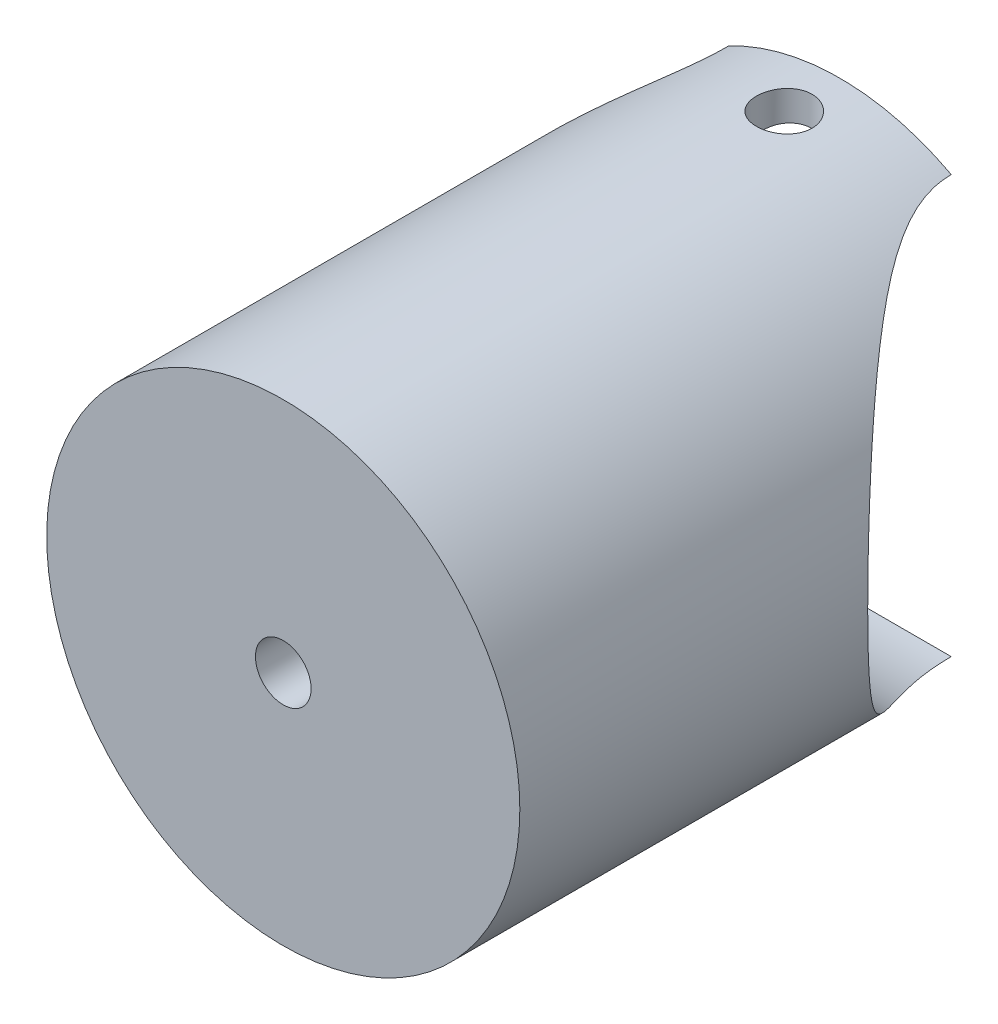
from build123d import *

# Parameters (mm, degrees)
SKETCH1_R               = 85
BOSS_EXTRUDE1_DEPTH     = 200
CUT_EXTRUDE1_DEPTH      = 234.345237792
CUT_EXTRUDE1_DEPTH_BACK = 234.345237792
SKETCH2_R               = 75
CUT_EXTRUDE3_DEPTH      = 234.34523795
CUT_EXTRUDE3_DEPTH_BACK = 234.34523795
SKETCH3_R               = 10
CUT_EXTRUDE4_DEPTH      = 234.34523795
CUT_EXTRUDE4_DEPTH_BACK = 234.34523795
SKETCH4_R               = 10


with BuildPart() as part:
    # Sketch1 → Boss-Extrude1 (new body)
    with BuildSketch(Plane.XY):
        Circle(SKETCH1_R)
    extrude(amount=BOSS_EXTRUDE1_DEPTH)

    # Sketch2 → Cut-Extrude1 (cut, two sides: drawn at the far end of the back side and taken through both)
    with BuildSketch(Plane(origin=(0, 0, 0), x_dir=(0, 0, -1), z_dir=(1, 0, 0)).offset(-CUT_EXTRUDE1_DEPTH_BACK)):
        Circle(SKETCH2_R)
    extrude(amount=CUT_EXTRUDE1_DEPTH + CUT_EXTRUDE1_DEPTH_BACK, mode=Mode.SUBTRACT)

    # Sketch3 → Cut-Extrude3 (cut, two sides: drawn at the far end of the back side and taken through both)
    with BuildSketch(Plane(origin=(0, 0, 0), x_dir=(1, 0, 0), z_dir=(0, 1, 0)).offset(-CUT_EXTRUDE3_DEPTH_BACK)):
        with Locations(Location((0, -20, 0), (0, 0, 270))):
            Circle(SKETCH3_R)
    extrude(amount=CUT_EXTRUDE3_DEPTH + CUT_EXTRUDE3_DEPTH_BACK, mode=Mode.SUBTRACT)

    # Sketch4 → Cut-Extrude4 (cut, two sides: drawn at the far end of the back side and taken through both)
    with BuildSketch(Plane.XY.offset(-CUT_EXTRUDE4_DEPTH_BACK)):
        Circle(SKETCH4_R)
    extrude(amount=CUT_EXTRUDE4_DEPTH + CUT_EXTRUDE4_DEPTH_BACK, mode=Mode.SUBTRACT)


solid = part.part
